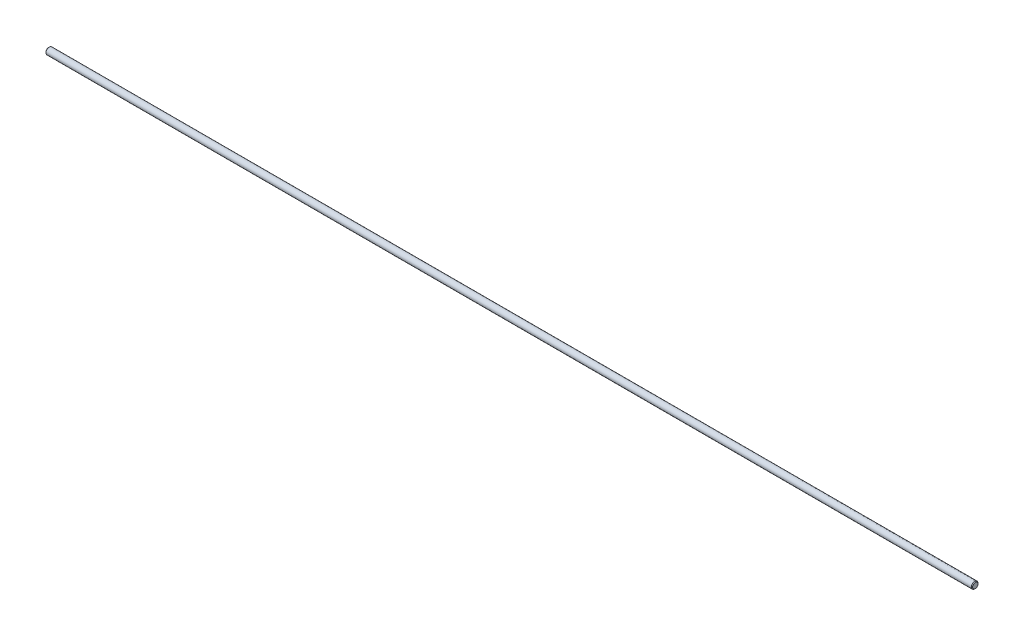
from build123d import *

# Parameters (mm, degrees)
EXTRUDE1_DEPTH      = 762
EXTRUDE1_DEPTH_BACK = 762
SKETCH2_R           = 4.7625
CHAMFER1_SIZE       = 0.9525
SKETCH3_R           = 12.540834079
CUT_EXTRUDE1_DEPTH  = 203.2
CHAMFER2_SIZE       = 0.9525


with BuildPart() as part:
    # Sketch2 → Extrude1 (new, two sides: drawn at the far end of the back side and taken through both)
    with BuildSketch(Plane(origin=(0, 0, 0), x_dir=(0, 0, -1), z_dir=(1, 0, 0)).offset(-EXTRUDE1_DEPTH_BACK)):
        Circle(SKETCH2_R)
    extrude(amount=EXTRUDE1_DEPTH + EXTRUDE1_DEPTH_BACK)

    # Chamfer1
    chamfer1_edges = [part.edges().sort_by_distance(p)[0] for p in [
        (-762, 0, 4.7625),
        (762, 0, 4.7625),
    ]]
    chamfer(chamfer1_edges, length=CHAMFER1_SIZE)

    # Sketch3 → Cut-Extrude1 (cut)
    with BuildSketch(Plane.ZY.offset(762)):
        Circle(SKETCH3_R)
    extrude(amount=-CUT_EXTRUDE1_DEPTH, mode=Mode.SUBTRACT)

    # Chamfer2
    chamfer2_edges = [part.edges().sort_by_distance(p)[0] for p in [
        (-558.8, 0, 4.7625),
    ]]
    chamfer(chamfer2_edges, length=CHAMFER2_SIZE)


solid = part.part
